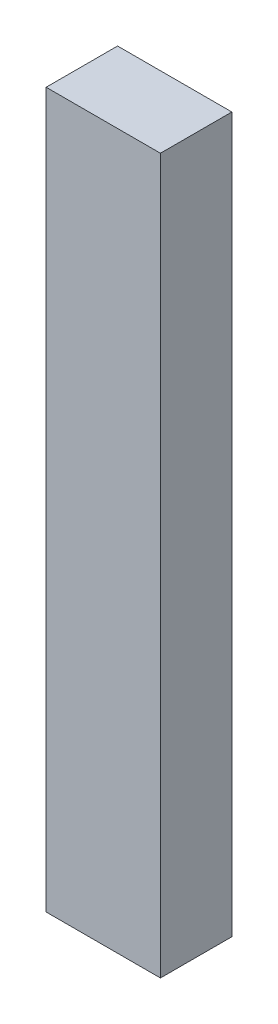
from build123d import *

# Parameters (mm, degrees)
SKETCH_2_W        = 50
SKETCH_2_H        = 500
SKETCH_2_W_2      = 46
SKETCH_2_H_2      = 496
EXTRUDE_1_DEPTH   = 80
SKETCH_3_W        = 50
SKETCH_3_H        = 500
EXTRUDE_1_2_DEPTH = 2


with BuildPart() as part:
    # 草图2 → Extrude 1 (new body)
    with BuildSketch(Plane(origin=(-5, 0, 0), x_dir=(0, 0, -1), z_dir=(1, 0, 0))):
        with Locations((25, 225)):
            Rectangle(SKETCH_2_W, SKETCH_2_H)
        with Locations((25, 225)):
            Rectangle(SKETCH_2_W_2, SKETCH_2_H_2, mode=Mode.SUBTRACT)
    extrude(amount=EXTRUDE_1_DEPTH)

    # 草图3 → Extrude 1 2 (add)
    with BuildSketch(Plane(origin=(75, 0, 0), x_dir=(0, 0, -1), z_dir=(1, 0, 0))):
        with Locations((25, 225)):
            Rectangle(SKETCH_3_W, SKETCH_3_H)
    extrude(amount=-EXTRUDE_1_2_DEPTH)


solid = part.part
